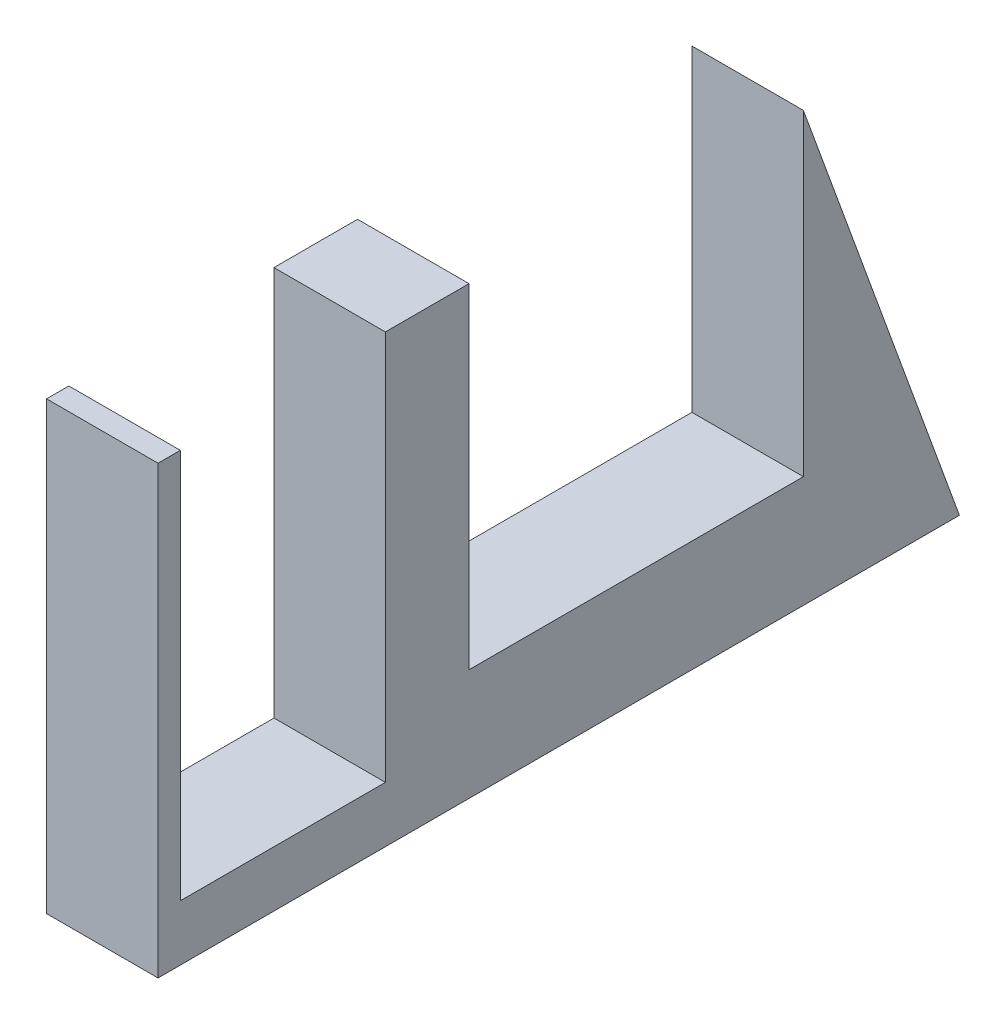
from build123d import *

# Parameters (mm, degrees)
BOSS_EXTRUDE1_DEPTH = 12.7


with BuildPart() as part:
    # Sketch1 → Boss-Extrude1 (new body)
    with BuildSketch(Plane(origin=(0, 0, 0), x_dir=(0, 0, -1), z_dir=(1, 0, 0))):
        Polygon((-45.6565, 0), (45.6565, 0), (27.8765, 48.850148518), (27.8765, 12.7), (-10.2235, 12.7), (-10.2235, 50.8), (-19.7485, 50.8), (-19.7485, 6.35), (-43.1165, 6.35), (-43.1165, 50.8), (-45.6565, 50.8), align=None)
    extrude(amount=BOSS_EXTRUDE1_DEPTH)


solid = part.part
